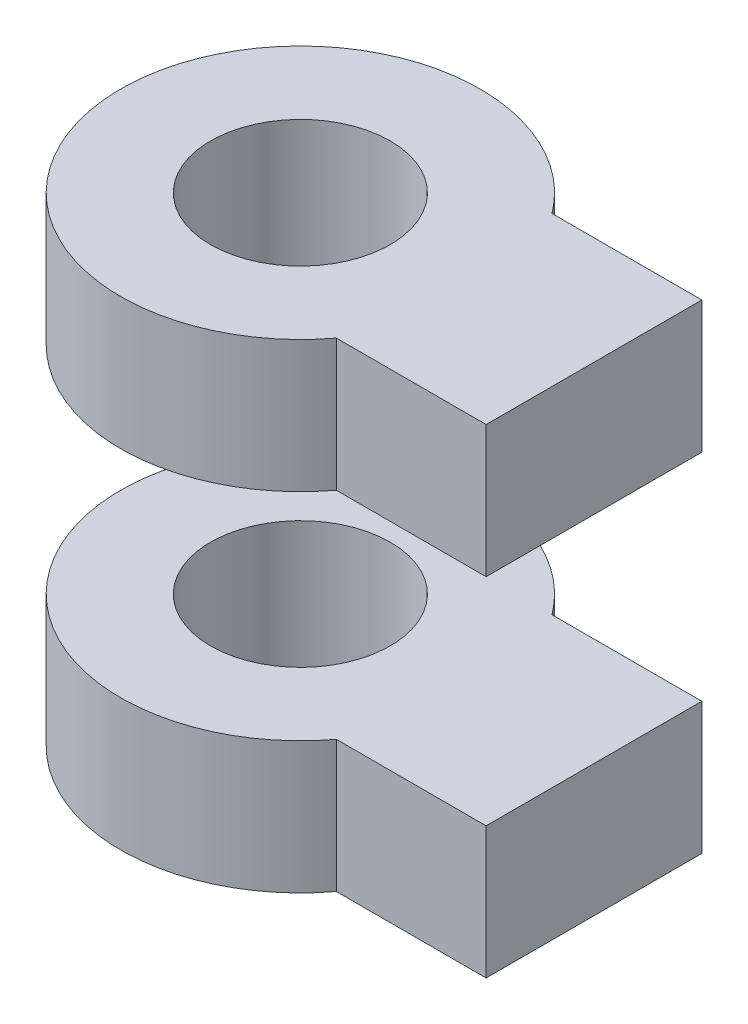
from build123d import *

# Parameters (mm, degrees)
CROQUIS3_R              = 15
SALIENTE_EXTRUIR3_DEPTH = 40
CROQUIS6_W              = 91.129860116
CROQUIS6_H              = 36
CORTAR_EXTRUIR2_DEPTH   = 40


with BuildPart() as part:
    # Croquis3 → Saliente-Extruir3 (new, symmetric)
    with BuildSketch(Plane(origin=(0, 0, 0), x_dir=(1, 0, 0), z_dir=(0, 1, 0))):
        with BuildLine():
            Line((24, -18), (49, -18))
            Line((49, -18), (49, 18))
            Line((49, 18), (24, 18))
            ThreePointArc((24, 18), (-30, 0), (24, -18))
        make_face()
        with Locations(Location((0, 0, 0), (0, 0, 270))):
            Circle(CROQUIS3_R, mode=Mode.SUBTRACT)
    extrude(amount=SALIENTE_EXTRUIR3_DEPTH, both=True)

    # Croquis6 → Cortar-Extruir2 (cut, symmetric)
    with BuildSketch(Plane.XY):
        with Locations((11.421412713, 0)):
            Rectangle(CROQUIS6_W, CROQUIS6_H)
    extrude(amount=CORTAR_EXTRUIR2_DEPTH, both=True, mode=Mode.SUBTRACT)


with BuildPart() as cortar_extruir2_piece_1:
    # of the separate pieces the step leaves, piece 1, a body of its own (cortar_extruir2_pieces)
    add(part.part.solids().sort_by_distance((24, -18, 18))[0])


with BuildPart() as cortar_extruir2_piece_2:
    # of the separate pieces the step leaves, piece 2, a body of its own (cortar_extruir2_pieces)
    add(part.part.solids().sort_by_distance((24, 40, 18))[0])


solid = Compound([cortar_extruir2_piece_1.part, cortar_extruir2_piece_2.part])
